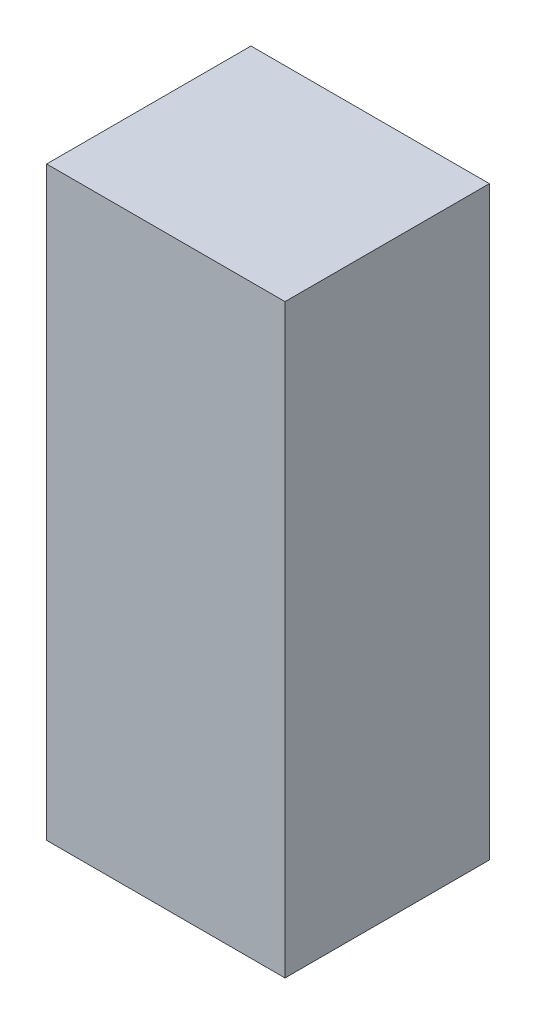
from build123d import *

# Parameters (mm, degrees)
BOSS_EXTRUDE1_DEPTH      = 610
BOSS_EXTRUDE1_DEPTH_BACK = 250
SKETCH1_W                = 350
SKETCH1_H                = 300


with BuildPart() as part:
    # Sketch1 → Boss-Extrude1 (new, two sides: drawn at the far end of the back side and taken through both)
    with BuildSketch(Plane(origin=(0, 0, 0), x_dir=(1, 0, 0), z_dir=(0, 1, 0)).offset(-BOSS_EXTRUDE1_DEPTH_BACK)):
        with Locations((175, -150)):
            Rectangle(SKETCH1_W, SKETCH1_H)
    extrude(amount=BOSS_EXTRUDE1_DEPTH + BOSS_EXTRUDE1_DEPTH_BACK)


solid = part.part
